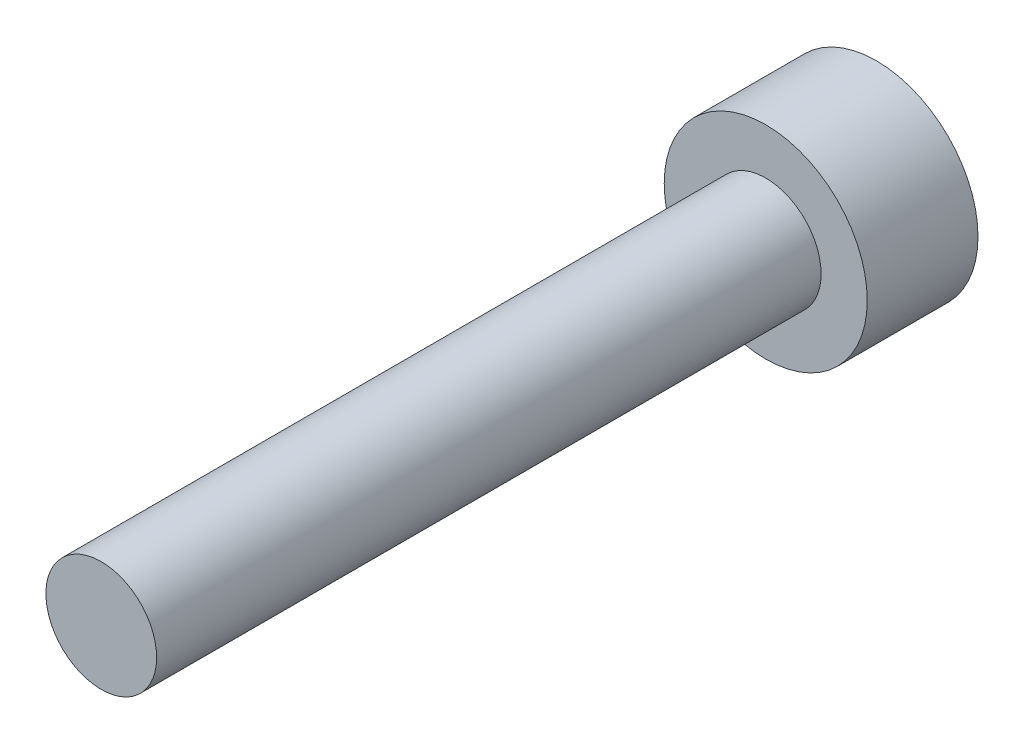
from build123d import *

# Parameters (mm, degrees)
F_01_START                = -3
S01_HEAD_R                = 2.75
F_01_HEAD_DEPTH           = 3
S02_NOMINAL_SHANK_R       = 1.5
F_02_NOMINAL_SHANK_DEPTH  = 18
F_03_START                = -3.1
F_03_HEX_KEY_SOCKET_DEPTH = 1.75


with BuildPart() as part:
    # S01 - Head → 01 - Head (new body)
    with BuildSketch(Plane.XY.offset(F_01_START)):
        Circle(S01_HEAD_R)
    extrude(amount=F_01_HEAD_DEPTH)

    # S02 - Nominal shank → 02 - Nominal shank (add)
    with BuildSketch(Plane.XY):
        Circle(S02_NOMINAL_SHANK_R)
    extrude(amount=F_02_NOMINAL_SHANK_DEPTH)

    # S03 - Hex key socket → 03 - Hex key socket (cut)
    with BuildSketch(Plane.XY.offset(F_03_START)):
        Polygon((1.443375673, 0), (0.721687836, 1.25), (-0.721687836, 1.25), (-1.443375673, 0), (-0.721687836, -1.25), (0.721687836, -1.25), align=None)
    extrude(amount=F_03_HEX_KEY_SOCKET_DEPTH, mode=Mode.SUBTRACT)


solid = part.part
